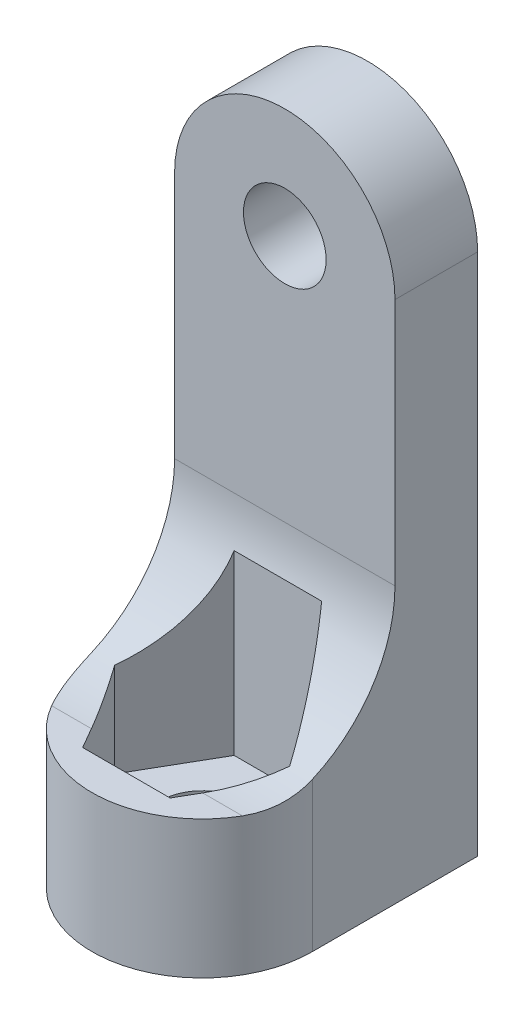
from build123d import *

# Parameters (mm, degrees)
SKICA1_R                 = 1.5
P_IDAT_VYSUNUT_M1_DEPTH  = 23
SKICA2_OUTSIDE_W         = 17.264
SKICA2_OUTSIDE_H         = 30.264
ODEBRAT_VYSUNUT_M2_DEPTH = 26.079872408
SKICA3_R                 = 1.5
ODEBRAT_VYSUNUT_M3_DEPTH = 26.396850254
ODEBRAT_VYSUNUT_M4_DEPTH = 23.203603329


with BuildPart() as part:
    # Skica1 → Přidat vysunutím1 (new body)
    with BuildSketch(Plane(origin=(0, 0, 0), x_dir=(1, 0, 0), z_dir=(0, 1, 0))):
        with BuildLine():
            Line((-4, 0), (-4, 6))
            Line((-4, 6), (4, 6))
            Line((4, 6), (4, 0))
            ThreePointArc((4, 0), (0, -4), (-4, 0))
        make_face()
        with Locations(Location((0, 0, 0), (0, 0, 270))):
            Circle(SKICA1_R, mode=Mode.SUBTRACT)
    extrude(amount=P_IDAT_VYSUNUT_M1_DEPTH)

    # Skica2 outside → Odebrat vysunutím2 (cut, through all)
    with BuildSketch(Plane.ZY.offset(4)):
        with Locations((-1, 11.5)):
            Rectangle(SKICA2_OUTSIDE_W, SKICA2_OUTSIDE_H)
        with BuildLine():
            Line((-3, 23), (-3, 10))
            ThreePointArc((-3, 10), (-1.535533906, 6.464466094), (2, 5))
            Line((2, 5), (4, 5))
            Line((4, 5), (4, 0))
            Line((4, 0), (-6, 0))
            Line((-6, 0), (-6, 23))
            Line((-6, 23), (-3, 23))
        make_face(mode=Mode.SUBTRACT)
    extrude(amount=-ODEBRAT_VYSUNUT_M2_DEPTH, mode=Mode.SUBTRACT)

    # Skica3 → Odebrat vysunutím3 (cut, through all)
    with BuildSketch(Plane(origin=(0, 0, -6), x_dir=(-1, 0, 0), z_dir=(0, 0, -1))):
        with Locations((0, 19)):
            Circle(SKICA3_R)
        with BuildLine():
            Line((-4, 19), (-7.602186301, 24.874773566))
            Line((-7.602186301, 24.874773566), (9.845338693, 23.958039202))
            Line((9.845338693, 23.958039202), (4, 19))
            ThreePointArc((4, 19), (0, 23), (-4, 19))
        make_face()
    extrude(amount=-ODEBRAT_VYSUNUT_M3_DEPTH, mode=Mode.SUBTRACT)

    # Skica6 → Odebrat vysunutím4 (cut, through all)
    with BuildSketch(Plane.XZ.offset(-2)):
        Polygon((1.58771324, 2.75), (-1.58771324, 2.75), (-3.175426481, 0), (-1.58771324, -2.75), (1.58771324, -2.75), (3.175426481, 0), align=None)
    extrude(amount=-ODEBRAT_VYSUNUT_M4_DEPTH, mode=Mode.SUBTRACT)


solid = part.part
